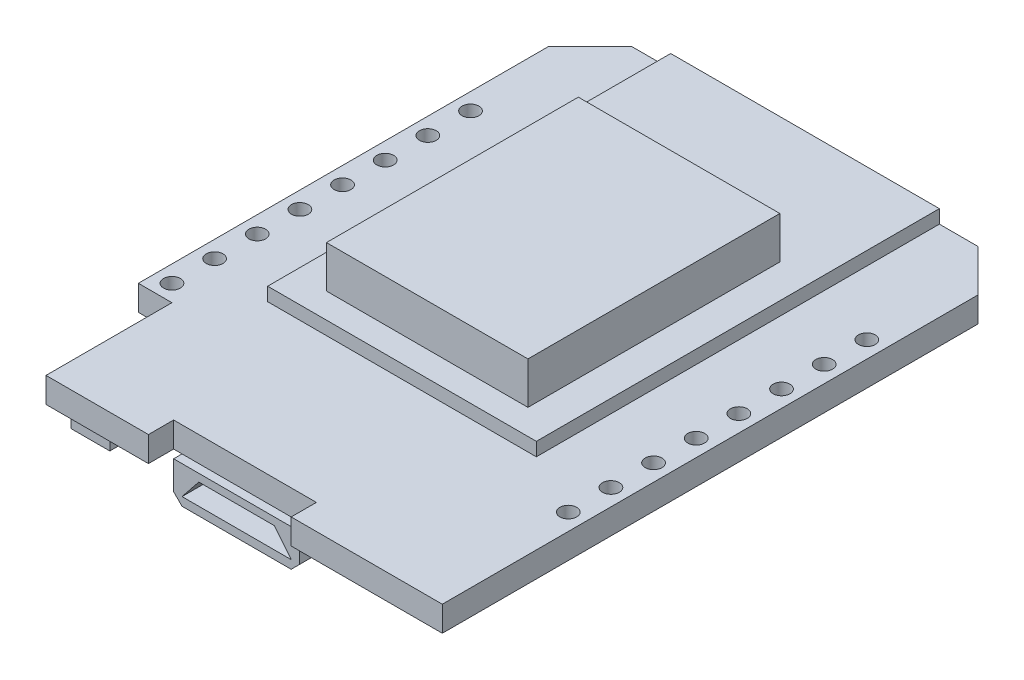
from build123d import *

# Parameters (mm, degrees)
SKETCH1_R               = 0.5
PCB_DEPTH               = 1.5
SKETCH2_W               = 16
SKETCH2_H               = 24
ESP8266_PCB_DEPTH       = 0.8
SKETCH3_W               = 12
SKETCH3_H               = 15
ESP8266_RF_SHIELD_DEPTH = 2.5
SKETCH5_W               = 7.5
SKETCH5_H               = 5.6
BOSS_EXTRUDE4_DEPTH     = 2.2
CHAMFER1_SIZE           = 0.5
CUT_EXTRUDE1_DEPTH      = 4
SKETCH5_4_W             = 2.3
SKETCH5_4_H             = 4.5
BUTTON_BODY_DEPTH       = 2
SKETCH11_W              = 2
SKETCH11_H              = 0.89493309
BUTTON_ACTUATOR_DEPTH   = 1
SKETCH5_5_W             = 1.5
SKETCH5_5_H             = 1
COMPONENTS1_DEPTH       = 1
SKETCH5_5_W_2           = 10.115707705
SKETCH5_5_H_2           = 4.574950916
COMPONENTS1_2_DEPTH     = 1
COMPONENTS1_3_DEPTH     = 1
COMPONENTS1_4_DEPTH     = 1
SKETCH5_5_W_3           = 1
SKETCH5_5_H_3           = 1.5
COMPONENTS1_5_DEPTH     = 1
SKETCH5_6_W             = 1.5
SKETCH5_6_H             = 1
COMPONENTS_2_DEPTH      = 0.5
COMPONENTS_2_2_DEPTH    = 0.5
COMPONENTS_2_3_DEPTH    = 0.5
COMPONENTS_2_4_DEPTH    = 0.5
COMPONENTS_2_5_DEPTH    = 0.5
COMPONENTS_2_6_DEPTH    = 0.5
COMPONENTS_2_7_DEPTH    = 0.5
COMPONENTS_2_8_DEPTH    = 0.5
COMPONENTS_2_9_DEPTH    = 0.5
SKETCH5_6_W_2           = 1
SKETCH5_6_H_2           = 2.730487257
COMPONENTS_2_10_DEPTH   = 0.5
COMPONENTS_2_11_DEPTH   = 0.5
SKETCH5_6_H_3           = 1.5
COMPONENTS_2_12_DEPTH   = 0.5
COMPONENTS_2_13_DEPTH   = 0.5
COMPONENTS_2_14_DEPTH   = 0.5
COMPONENTS_2_15_DEPTH   = 0.5
COMPONENTS_2_16_DEPTH   = 0.5
COMPONENTS_2_17_DEPTH   = 0.5
COMPONENTS_2_18_DEPTH   = 0.5
COMPONENTS_2_19_DEPTH   = 0.5
COMPONENTS_2_20_DEPTH   = 0.5
COMPONENTS_2_21_DEPTH   = 0.5


with BuildPart() as part:
    # Sketch1 → PCB (new body)
    with BuildSketch(Plane(origin=(0, 0, 0), x_dir=(1, 0, 0), z_dir=(0, 1, 0))):
        Polygon((0, 0), (0, 31.9), (-2.5, 34.4), (-23.1, 34.4), (-25.6, 31.9), (-25.6, 7.5), (-23.6, 7.5), (-23.6, 0), (-17.5, 0), (-17.5, 1.5), (-9, 1.5), (-9, 0), align=None)
        with Locations(Location((-24.6, 8.5, 0), (0, 0, 270))):
            Circle(SKETCH1_R, mode=Mode.SUBTRACT)
        with Locations(Location((-1, 8.5, 0), (0, 0, 270))):
            Circle(SKETCH1_R, mode=Mode.SUBTRACT)
        with Locations(Location((-24.6, 11.04, 0), (0, 0, 270))):
            Circle(SKETCH1_R, mode=Mode.SUBTRACT)
        with Locations(Location((-1, 11.04, 0), (0, 0, 270))):
            Circle(SKETCH1_R, mode=Mode.SUBTRACT)
        with Locations(Location((-24.6, 13.58, 0), (0, 0, 270))):
            Circle(SKETCH1_R, mode=Mode.SUBTRACT)
        with Locations(Location((-1, 13.58, 0), (0, 0, 270))):
            Circle(SKETCH1_R, mode=Mode.SUBTRACT)
        with Locations(Location((-24.6, 16.12, 0), (0, 0, 270))):
            Circle(SKETCH1_R, mode=Mode.SUBTRACT)
        with Locations(Location((-1, 16.12, 0), (0, 0, 270))):
            Circle(SKETCH1_R, mode=Mode.SUBTRACT)
        with Locations(Location((-24.6, 18.66, 0), (0, 0, 270))):
            Circle(SKETCH1_R, mode=Mode.SUBTRACT)
        with Locations(Location((-1, 18.66, 0), (0, 0, 270))):
            Circle(SKETCH1_R, mode=Mode.SUBTRACT)
        with Locations(Location((-24.6, 21.2, 0), (0, 0, 270))):
            Circle(SKETCH1_R, mode=Mode.SUBTRACT)
        with Locations(Location((-1, 21.2, 0), (0, 0, 270))):
            Circle(SKETCH1_R, mode=Mode.SUBTRACT)
        with Locations(Location((-24.6, 23.74, 0), (0, 0, 270))):
            Circle(SKETCH1_R, mode=Mode.SUBTRACT)
        with Locations(Location((-1, 23.74, 0), (0, 0, 270))):
            Circle(SKETCH1_R, mode=Mode.SUBTRACT)
        with Locations(Location((-24.6, 26.28, 0), (0, 0, 270))):
            Circle(SKETCH1_R, mode=Mode.SUBTRACT)
        with Locations(Location((-1, 26.28, 0), (0, 0, 270))):
            Circle(SKETCH1_R, mode=Mode.SUBTRACT)
    extrude(amount=PCB_DEPTH)


with BuildPart() as body_2:
    # Sketch2 → ESP8266 PCB (new body)
    with BuildSketch(Plane(origin=(0, 1.5, 0), x_dir=(1, 0, 0), z_dir=(0, 1, 0))):
        with Locations((-12.8, 22.4)):
            Rectangle(SKETCH2_W, SKETCH2_H)
    extrude(amount=ESP8266_PCB_DEPTH)


with BuildPart() as body_3:
    # Sketch3 → ESP8266 Rf Shield (new body)
    with BuildSketch(Plane(origin=(0, 2.3, 0), x_dir=(1, 0, 0), z_dir=(0, 1, 0))):
        with Locations((-12.8, 19.4)):
            Rectangle(SKETCH3_W, SKETCH3_H)
    extrude(amount=ESP8266_RF_SHIELD_DEPTH)


with BuildPart() as body_4:
    # Sketch5 → Boss-Extrude4 (new body)
    with BuildSketch(Plane.XZ):
        with Locations((-13.25, -3.8)):
            Rectangle(SKETCH5_W, SKETCH5_H)
    extrude(amount=BOSS_EXTRUDE4_DEPTH)

    # Chamfer1
    chamfer1_edges = [body_4.edges().sort_by_distance(p)[0] for p in [
        (-17, -2.2, -3.8),
        (-9.5, -2.2, -3.8),
    ]]
    chamfer(chamfer1_edges, length=CHAMFER1_SIZE)

    # Sketch12 → Cut-Extrude1 (cut)
    with BuildSketch(Plane.XY.offset(-1)):
        Polygon((-15.5, -0.45), (-11, -0.45), (-10, -1.7), (-16.5, -1.7), align=None)
    extrude(amount=-CUT_EXTRUDE1_DEPTH, mode=Mode.SUBTRACT)


with BuildPart() as body_5:
    # Sketch5<4> → Button Body (new body)
    with BuildSketch(Plane.XZ):
        with Locations((-22.45, -3.75)):
            Rectangle(SKETCH5_4_W, SKETCH5_4_H)
    extrude(amount=BUTTON_BODY_DEPTH)


with BuildPart() as body_6:
    # Sketch11 → Button Actuator (new body)
    with BuildSketch(Plane.ZY.offset(23.6)):
        with Locations((-3.75, -1)):
            Rectangle(SKETCH11_W, SKETCH11_H)
    extrude(amount=BUTTON_ACTUATOR_DEPTH)


with BuildPart() as body_7:
    # Sketch5<5> → Components1 (new body)
    with BuildSketch(Plane.XZ):
        with Locations((-3.164431534, -3.205591578)):
            Rectangle(SKETCH5_5_W, SKETCH5_5_H)
    extrude(amount=COMPONENTS1_DEPTH)


with BuildPart() as body_8:
    # Sketch5<5> → Components1 2 (new body)
    with BuildSketch(Plane.XZ):
        with Locations((-13.706412385, -12.112524542)):
            Rectangle(SKETCH5_5_W_2, SKETCH5_5_H_2)
    extrude(amount=COMPONENTS1_2_DEPTH)


with BuildPart() as body_9:
    # Sketch5<5> → Components1 3 (new body)
    with BuildSketch(Plane.XZ):
        with Locations((-12.85, -27.9)):
            Rectangle(SKETCH5_5_W, SKETCH5_5_H)
    extrude(amount=COMPONENTS1_3_DEPTH)


with BuildPart() as body_10:
    # Sketch5<5> → Components1 4 (new body)
    with BuildSketch(Plane.XZ):
        with Locations((-12.85, -17.9)):
            Rectangle(SKETCH5_5_W, SKETCH5_5_H)
    extrude(amount=COMPONENTS1_4_DEPTH)


with BuildPart() as body_11:
    # Sketch5<5> → Components1 5 (new body)
    with BuildSketch(Plane.XZ):
        with Locations((-7.859161772, -2.586878922)):
            Rectangle(SKETCH5_5_W_3, SKETCH5_5_H_3)
    extrude(amount=COMPONENTS1_5_DEPTH)


with BuildPart() as body_12:
    # Sketch5<6> → Components 2 (new body)
    with BuildSketch(Plane.XZ):
        with Locations((-19.35, -15.9)):
            Rectangle(SKETCH5_6_W, SKETCH5_6_H)
    extrude(amount=COMPONENTS_2_DEPTH)


with BuildPart() as body_13:
    # Sketch5<6> → Components 2 2 (new body)
    with BuildSketch(Plane.XZ):
        with Locations((-19.35, -17.9)):
            Rectangle(SKETCH5_6_W, SKETCH5_6_H)
    extrude(amount=COMPONENTS_2_2_DEPTH)


with BuildPart() as body_14:
    # Sketch5<6> → Components 2 3 (new body)
    with BuildSketch(Plane.XZ):
        with Locations((-19.35, -19.9)):
            Rectangle(SKETCH5_6_W, SKETCH5_6_H)
    extrude(amount=COMPONENTS_2_3_DEPTH)


with BuildPart() as body_15:
    # Sketch5<6> → Components 2 4 (new body)
    with BuildSketch(Plane.XZ):
        with Locations((-19.35, -21.9)):
            Rectangle(SKETCH5_6_W, SKETCH5_6_H)
    extrude(amount=COMPONENTS_2_4_DEPTH)


with BuildPart() as body_16:
    # Sketch5<6> → Components 2 5 (new body)
    with BuildSketch(Plane.XZ):
        with Locations((-19.35, -23.9)):
            Rectangle(SKETCH5_6_W, SKETCH5_6_H)
    extrude(amount=COMPONENTS_2_5_DEPTH)


with BuildPart() as body_17:
    # Sketch5<6> → Components 2 6 (new body)
    with BuildSketch(Plane.XZ):
        with Locations((-19.35, -25.9)):
            Rectangle(SKETCH5_6_W, SKETCH5_6_H)
    extrude(amount=COMPONENTS_2_6_DEPTH)


with BuildPart() as body_18:
    # Sketch5<6> → Components 2 7 (new body)
    with BuildSketch(Plane.XZ):
        with Locations((-19.35, -27.9)):
            Rectangle(SKETCH5_6_W, SKETCH5_6_H)
    extrude(amount=COMPONENTS_2_7_DEPTH)


with BuildPart() as body_19:
    # Sketch5<6> → Components 2 8 (new body)
    with BuildSketch(Plane.XZ):
        with Locations((-12.85, -23.9)):
            Rectangle(SKETCH5_6_W, SKETCH5_6_H)
    extrude(amount=COMPONENTS_2_8_DEPTH)


with BuildPart() as body_20:
    # Sketch5<6> → Components 2 9 (new body)
    with BuildSketch(Plane.XZ):
        with Locations((-12.85, -21.9)):
            Rectangle(SKETCH5_6_W, SKETCH5_6_H)
    extrude(amount=COMPONENTS_2_9_DEPTH)


with BuildPart() as body_21:
    # Sketch5<6> → Components 2 10 (new body)
    with BuildSketch(Plane.XZ):
        with Locations((-18.856957667, -6.674141125)):
            Rectangle(SKETCH5_6_W_2, SKETCH5_6_H_2)
    extrude(amount=COMPONENTS_2_10_DEPTH)


with BuildPart() as body_22:
    # Sketch5<6> → Components 2 11 (new body)
    with BuildSketch(Plane.XZ):
        with Locations((-4.664431534, -1.336878922)):
            Rectangle(SKETCH5_6_W, SKETCH5_6_H)
    extrude(amount=COMPONENTS_2_11_DEPTH)


with BuildPart() as body_23:
    # Sketch5<6> → Components 2 12 (new body)
    with BuildSketch(Plane.XZ):
        with Locations((-7.752386826, -6.644686373)):
            Rectangle(SKETCH5_6_W_2, SKETCH5_6_H_3)
    extrude(amount=COMPONENTS_2_12_DEPTH)


with BuildPart() as body_24:
    # Sketch5<6> → Components 2 13 (new body)
    with BuildSketch(Plane.XZ):
        with Locations((-3.619512743, -6.732470951)):
            Rectangle(SKETCH5_6_W, SKETCH5_6_H)
    extrude(amount=COMPONENTS_2_13_DEPTH)


with BuildPart() as body_25:
    # Sketch5<6> → Components 2 14 (new body)
    with BuildSketch(Plane.XZ):
        with Locations((-4.976980779, -10.171565746)):
            Rectangle(SKETCH5_6_W_2, SKETCH5_6_H_3)
    extrude(amount=COMPONENTS_2_14_DEPTH)


with BuildPart() as body_26:
    # Sketch5<6> → Components 2 15 (new body)
    with BuildSketch(Plane.XZ):
        with Locations((-6.576760368, -10.171565746)):
            Rectangle(SKETCH5_6_W_2, SKETCH5_6_H_3)
    extrude(amount=COMPONENTS_2_15_DEPTH)


with BuildPart() as body_27:
    # Sketch5<6> → Components 2 16 (new body)
    with BuildSketch(Plane.XZ):
        with Locations((-6.35, -13.9)):
            Rectangle(SKETCH5_6_W, SKETCH5_6_H)
    extrude(amount=COMPONENTS_2_16_DEPTH)


with BuildPart() as body_28:
    # Sketch5<6> → Components 2 17 (new body)
    with BuildSketch(Plane.XZ):
        with Locations((-6.35, -15.9)):
            Rectangle(SKETCH5_6_W, SKETCH5_6_H)
    extrude(amount=COMPONENTS_2_17_DEPTH)


with BuildPart() as body_29:
    # Sketch5<6> → Components 2 18 (new body)
    with BuildSketch(Plane.XZ):
        with Locations((-6.35, -17.9)):
            Rectangle(SKETCH5_6_W, SKETCH5_6_H)
    extrude(amount=COMPONENTS_2_18_DEPTH)


with BuildPart() as body_30:
    # Sketch5<6> → Components 2 19 (new body)
    with BuildSketch(Plane.XZ):
        with Locations((-6.35, -19.9)):
            Rectangle(SKETCH5_6_W, SKETCH5_6_H)
    extrude(amount=COMPONENTS_2_19_DEPTH)


with BuildPart() as body_31:
    # Sketch5<6> → Components 2 20 (new body)
    with BuildSketch(Plane.XZ):
        with Locations((-6.35, -25.9)):
            Rectangle(SKETCH5_6_W, SKETCH5_6_H)
    extrude(amount=COMPONENTS_2_20_DEPTH)


with BuildPart() as body_32:
    # Sketch5<6> → Components 2 21 (new body)
    with BuildSketch(Plane.XZ):
        with Locations((-6.35, -27.9)):
            Rectangle(SKETCH5_6_W, SKETCH5_6_H)
    extrude(amount=COMPONENTS_2_21_DEPTH)


solid = Compound([part.part, body_2.part, body_3.part, body_4.part, body_5.part, body_6.part, body_7.part, body_8.part, body_9.part, body_10.part, body_11.part, body_12.part, body_13.part, body_14.part, body_15.part, body_16.part, body_17.part, body_18.part, body_19.part, body_20.part, body_21.part, body_22.part, body_23.part, body_24.part, body_25.part, body_26.part, body_27.part, body_28.part, body_29.part, body_30.part, body_31.part, body_32.part])
